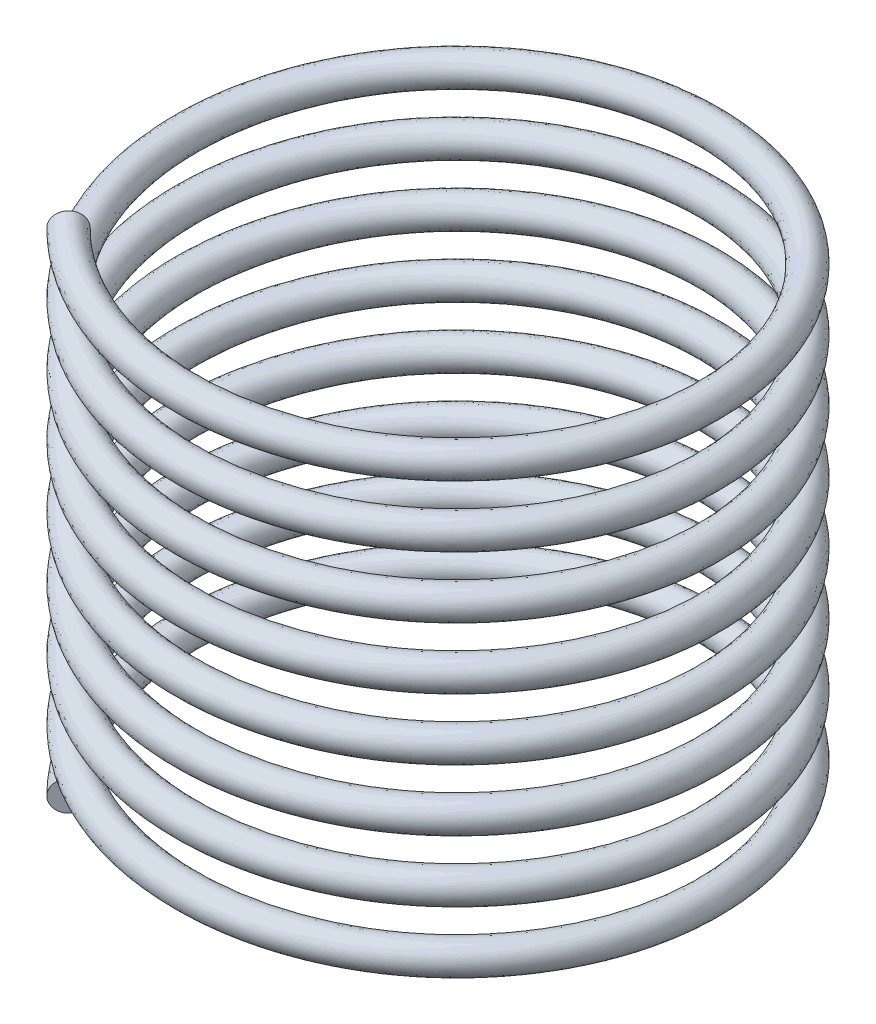
from build123d import *

# Parameters (mm, degrees)
SWEEP1_PITCH       = 1
SWEEP1_HEIGHT      = 8
SWEEP1_RADIUS      = 4.25
SWEEP1_START_ANGLE = -45
SWEEP1_PROFILE_R   = 0.25


with BuildPart() as part:
    # Sweep1: sweep along a helix
    with BuildLine() as sweep1_path:
        add(Helix(SWEEP1_PITCH, SWEEP1_HEIGHT, SWEEP1_RADIUS, center=(0, 0, 0), direction=(0, 1, 0), lefthand=True, mode=Mode.PRIVATE).rotate(Axis((0, 0, 0), (0, 1, 0)), SWEEP1_START_ANGLE))
    # Sweep1 profile (on start of the path) → Sweep1 (sweep)
    with BuildSketch(Plane(origin=(-3.00520382, 0, 3.00520382), x_dir=(0.7071067811862208, 0, -0.7071067811868742), z_dir=(-0.7066114896330161, 0.037421991370619065, -0.7066114896323632))):
        Circle(SWEEP1_PROFILE_R)
    sweep(path=sweep1_path.line, is_frenet=True)


solid = part.part
